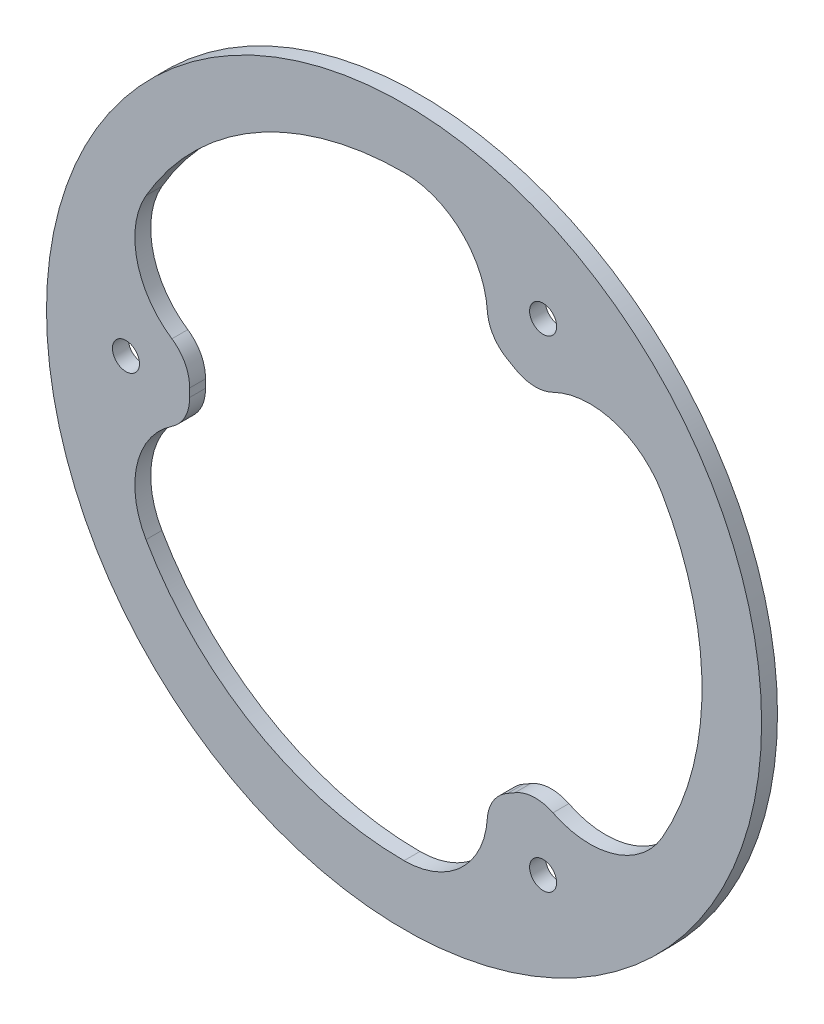
from build123d import *

# Parameters (mm, degrees)
SKETCH_1_R          = 40
EXTRUDE_1_DEPTH     = 12
SKETCH_8_R          = 45
EXTRUDE_3_DEPTH     = 2
SKETCH_2_R          = 7.5
CUT_EXTRUDE_1_DEPTH = 66.161338231
HOLE_WIZARD_M32_D   = 3.4
CUT_EXTRUDE_2_DEPTH = 66.161338231
HOLE_WIZARD_M33_D   = 3.4
SKETCH_17_R         = 42.242904023
CUT_EXTRUDE_3_DEPTH = 12
SKETCH_18_R         = 27
CUT_EXTRUDE_4_DEPTH = 64.671029519
FILLET_1_R          = 5


with BuildPart() as part:
    # Эскиз1 → Бобышка-Вытянуть1 (new body)
    with BuildSketch(Plane.XY):
        Circle(SKETCH_1_R)
    extrude(amount=EXTRUDE_1_DEPTH)

    # Эскиз8 → Бобышка-Вытянуть3 (add)
    with BuildSketch(Plane.XY.offset(12)):
        Circle(SKETCH_8_R)
    extrude(amount=EXTRUDE_3_DEPTH)

    # Эскиз2 → Вырез-Вытянуть1 (cut, through all)
    with BuildSketch(Plane(origin=(0, 0, 14), x_dir=(-1, 0, 0), z_dir=(0, 0, -1))):
        Circle(SKETCH_2_R)
    extrude(amount=CUT_EXTRUDE_1_DEPTH, mode=Mode.SUBTRACT)

    # Отверстие с зазором M32 (through all)
    with Locations(Plane.XY.offset(14)):
        with Locations((6.25, 10.825317547), (-12.5, 0), (6.25, -10.825317547)):
            Hole(HOLE_WIZARD_M32_D / 2)

    # Эскиз10 → Вырез-Вытянуть2 (cut, through all)
    with BuildSketch(Plane(origin=(0, 0, 0), x_dir=(-1, 0, 0), z_dir=(0, 0, -1))):
        with BuildLine():
            ThreePointArc((32.475952642, -18.75), (28.632685902, -4.40673326), (14.289419162, -8.25))
            ThreePointArc((14.289419162, -8.25), (8.25, -14.289419162), (0, -16.5))
            ThreePointArc((0, -16.5), (-10.5, -27), (0, -37.5))
            ThreePointArc((0, -37.5), (18.75, -32.475952642), (32.475952642, -18.75))
        make_face()
        with BuildLine():
            ThreePointArc((32.475952642, 18.75), (18.75, 32.475952642), (0, 37.5))
            ThreePointArc((0, 37.5), (-10.5, 27), (0, 16.5))
            ThreePointArc((0, 16.5), (8.25, 14.289419162), (14.289419162, 8.25))
            ThreePointArc((14.289419162, 8.25), (28.632685902, 4.40673326), (32.475952642, 18.75))
        make_face()
        with BuildLine():
            ThreePointArc((-32.475952642, -18.75), (-18.132685902, -22.59326674), (-14.289419162, -8.25))
            ThreePointArc((-14.289419162, -8.25), (-16.5, 0), (-14.289419162, 8.25))
            ThreePointArc((-14.289419162, 8.25), (-18.132685902, 22.59326674), (-32.475952642, 18.75))
            ThreePointArc((-32.475952642, 18.75), (-37.5, 0), (-32.475952642, -18.75))
        make_face()
    extrude(amount=-CUT_EXTRUDE_2_DEPTH, mode=Mode.SUBTRACT)

    # Отверстие с зазором M33 (through all)
    with Locations(Plane(origin=(0, 0, 0), x_dir=(-1, 0, 0), z_dir=(0, 0, -1))):
        with Locations((-17.5, 30.310889132), (35, 0), (-17.5, -30.310889132)):
            Hole(HOLE_WIZARD_M33_D / 2)

    # Эскиз17 → Вырез-Вытянуть3 (cut)
    with BuildSketch(Plane(origin=(0, 0, 0), x_dir=(-1, 0, 0), z_dir=(0, 0, -1))):
        Circle(SKETCH_17_R)
    extrude(amount=-CUT_EXTRUDE_3_DEPTH, mode=Mode.SUBTRACT)

    # Эскиз18 → Вырез-Вытянуть4 (cut, through all)
    with BuildSketch(Plane(origin=(0, 0, 12), x_dir=(-1, 0, 0), z_dir=(0, 0, -1))):
        Circle(SKETCH_18_R)
    extrude(amount=-CUT_EXTRUDE_4_DEPTH, mode=Mode.SUBTRACT)

    # Скругление1
    fillet_1_edges = [part.edges().sort_by_distance(p)[0] for p in [
        (16.464754658, 21.398875065, 13),
        (10.29959209, 24.958333333, 13),
        (-26.764346748, 3.559458268, 13),
        (-26.764346748, -3.559458268, 13),
        (10.29959209, -24.958333333, 13),
        (16.464754658, -21.398875065, 13),
    ]]
    fillet(fillet_1_edges, radius=FILLET_1_R)


solid = part.part
